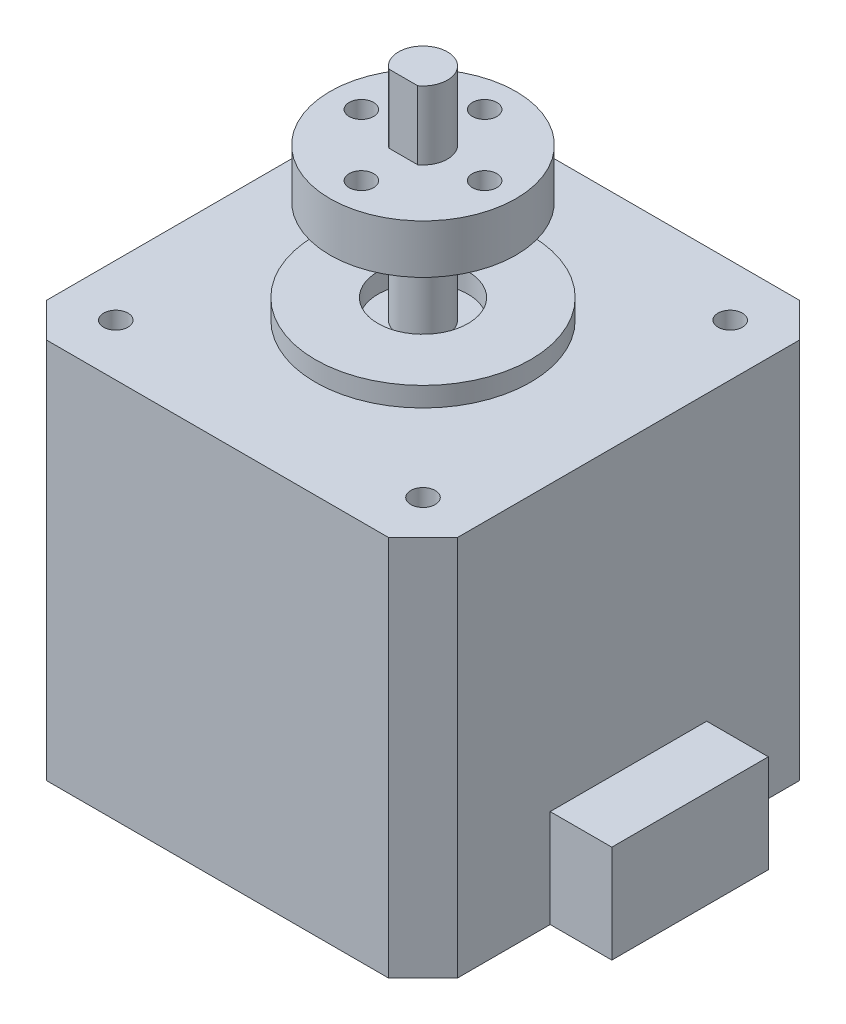
from build123d import *

# Parameters (mm, degrees)
BOSS_EXTRU_1_DEPTH      = 39
ESQUISSE2_R             = 1.25
ENL_V_MAT_EXTRU_1_DEPTH = 39
ESQUISSE3_R             = 11
ESQUISSE3_R_2           = 4.6
BOSS_EXTRU_2_DEPTH      = 2
ESQUISSE4_R             = 2.5
BOSS_EXTRU_3_DEPTH      = 22.5
ESQUISSE5_W             = 9.5
ESQUISSE5_H             = 5
ENL_V_MAT_EXTRU_2_REACH = 83.969
ESQUISSE6_R             = 1.25
ENL_V_START             = -7
ENL_V_MAT_EXTRU_4_DEPTH = 7
ESQUISSE9_W             = 16
ESQUISSE9_H             = 10
BOSS_EXTRU_4_DEPTH      = 6.3


with BuildPart() as part:
    # Esquisse1 → Boss.-Extru.1 (new body)
    with BuildSketch(Plane(origin=(0, 0, 0), x_dir=(1, 0, 0), z_dir=(0, 1, 0))):
        Polygon((3.535533906, 2.549558154), (0, 6.08509206), (0, 41.014024248), (3.535533906, 44.549558154), (38.464466094, 44.549558154), (42, 41.014024248), (42, 6.08509206), (38.464466094, 2.549558154), align=None)
    extrude(amount=BOSS_EXTRU_1_DEPTH)

    # Esquisse2 → Enlèv. mat.-Extru.1 (cut)
    with BuildSketch(Plane(origin=(0, 39, 0), x_dir=(1, 0, 0), z_dir=(0, 1, 0))):
        with Locations(Location((5.3, 39.249558154, 0), (0, 0, 270))):
            Circle(ESQUISSE2_R)
        with Locations(Location((36.7, 39.249558154, 0), (0, 0, 270))):
            Circle(ESQUISSE2_R)
        with Locations(Location((36.7, 7.849558154, 0), (0, 0, 270))):
            Circle(ESQUISSE2_R)
        with Locations(Location((5.3, 7.849558154, 0), (0, 0, 270))):
            Circle(ESQUISSE2_R)
    extrude(amount=-ENL_V_MAT_EXTRU_1_DEPTH, mode=Mode.SUBTRACT)

    # Esquisse3 → Boss.-Extru.2 (add)
    with BuildSketch(Plane(origin=(0, 39, 0), x_dir=(1, 0, 0), z_dir=(0, 1, 0))):
        with Locations(Location((21, 23.549558154, 0), (0, 0, 90))):
            Circle(ESQUISSE3_R)
        with Locations(Location((21, 23.549558154, 0), (0, 0, 270))):
            Circle(ESQUISSE3_R_2, mode=Mode.SUBTRACT)
    extrude(amount=BOSS_EXTRU_2_DEPTH)

    # Esquisse4 → Boss.-Extru.3 (add)
    with BuildSketch(Plane(origin=(0, 39, 0), x_dir=(1, 0, 0), z_dir=(0, 1, 0))):
        with Locations(Location((21, 23.549558154, 0), (0, 0, 90))):
            Circle(ESQUISSE4_R)
    extrude(amount=BOSS_EXTRU_3_DEPTH)

    # Esquisse5 → Révolution1 (revolve)
    with BuildSketch(Plane(origin=(21, 0, 0), x_dir=(0, 0, -1), z_dir=(1, 0, 0)), mode=Mode.PRIVATE) as r_volution1_sk:
        with Locations((18.799558154, 52)):
            Rectangle(ESQUISSE5_W, ESQUISSE5_H)
    revolve(r_volution1_sk.sketch.rotate(Axis((21, 61.5, -23.549558154), (0, -1, 0)), 180), axis=Axis((21, 61.5, -23.549558154), (0, -1, 0)))

    # Esquisse6 → Enlèv. mat.-Extru.2 (cut, up to next)
    with BuildSketch(Plane(origin=(0, 54.5, 0), x_dir=(1, 0, 0), z_dir=(0, 1, 0)), mode=Mode.PRIVATE) as enl_v_mat_extru_2_sk1:
        with Locations(Location((27.3, 23.549558154, 0), (0, 0, 270))):
            Circle(ESQUISSE6_R)
    enl_v_mat_extru_2_tool1 = extrude(enl_v_mat_extru_2_sk1.sketch, amount=-ENL_V_MAT_EXTRU_2_REACH, mode=Mode.PRIVATE) & part.part
    # Esquisse6 → Enlèv. mat.-Extru.2 (cut, up to next)
    with BuildSketch(Plane(origin=(0, 54.5, 0), x_dir=(1, 0, 0), z_dir=(0, 1, 0)), mode=Mode.PRIVATE) as enl_v_mat_extru_2_sk2:
        with Locations(Location((21, 17.249558154, 0), (0, 0, 270))):
            Circle(ESQUISSE6_R)
    enl_v_mat_extru_2_tool2 = extrude(enl_v_mat_extru_2_sk2.sketch, amount=-ENL_V_MAT_EXTRU_2_REACH, mode=Mode.PRIVATE) & part.part
    # Esquisse6 → Enlèv. mat.-Extru.2 (cut, up to next)
    with BuildSketch(Plane(origin=(0, 54.5, 0), x_dir=(1, 0, 0), z_dir=(0, 1, 0)), mode=Mode.PRIVATE) as enl_v_mat_extru_2_sk3:
        with Locations(Location((14.7, 23.549558154, 0), (0, 0, 270))):
            Circle(ESQUISSE6_R)
    enl_v_mat_extru_2_tool3 = extrude(enl_v_mat_extru_2_sk3.sketch, amount=-ENL_V_MAT_EXTRU_2_REACH, mode=Mode.PRIVATE) & part.part
    # Esquisse6 → Enlèv. mat.-Extru.2 (cut, up to next)
    with BuildSketch(Plane(origin=(0, 54.5, 0), x_dir=(1, 0, 0), z_dir=(0, 1, 0)), mode=Mode.PRIVATE) as enl_v_mat_extru_2_sk4:
        with Locations(Location((21, 29.849558154, 0), (0, 0, 270))):
            Circle(ESQUISSE6_R)
    enl_v_mat_extru_2_tool4 = extrude(enl_v_mat_extru_2_sk4.sketch, amount=-ENL_V_MAT_EXTRU_2_REACH, mode=Mode.PRIVATE) & part.part
    add(enl_v_mat_extru_2_tool1.solids().sort_by_distance((27.3, 54.5, -23.549558))[0], mode=Mode.SUBTRACT)
    add(enl_v_mat_extru_2_tool2.solids().sort_by_distance((21, 54.5, -17.249558))[0], mode=Mode.SUBTRACT)
    add(enl_v_mat_extru_2_tool3.solids().sort_by_distance((14.7, 54.5, -23.549558))[0], mode=Mode.SUBTRACT)
    add(enl_v_mat_extru_2_tool4.solids().sort_by_distance((21, 54.5, -29.849558))[0], mode=Mode.SUBTRACT)

    # Esquisse8 → Enlèv. mat.-Extru.4 (cut)
    with BuildSketch(Plane(origin=(0, 61.5, 0), x_dir=(1, 0, 0), z_dir=(0, 1, 0)).offset(ENL_V_START)):
        with BuildLine():
            Line((22.47490916, 21.530983664), (19.52509084, 21.530983664))
            ThreePointArc((19.52509084, 21.530983664), (21, 21.049558154), (22.47490916, 21.530983664))
        make_face()
    extrude(amount=ENL_V_MAT_EXTRU_4_DEPTH, mode=Mode.SUBTRACT)

    # Esquisse9 → Boss.-Extru.4 (add)
    with BuildSketch(Plane(origin=(42, 0, 0), x_dir=(0, 0, -1), z_dir=(1, 0, 0))):
        with Locations((23.549024248, 5)):
            Rectangle(ESQUISSE9_W, ESQUISSE9_H)
    extrude(amount=BOSS_EXTRU_4_DEPTH)


solid = part.part
